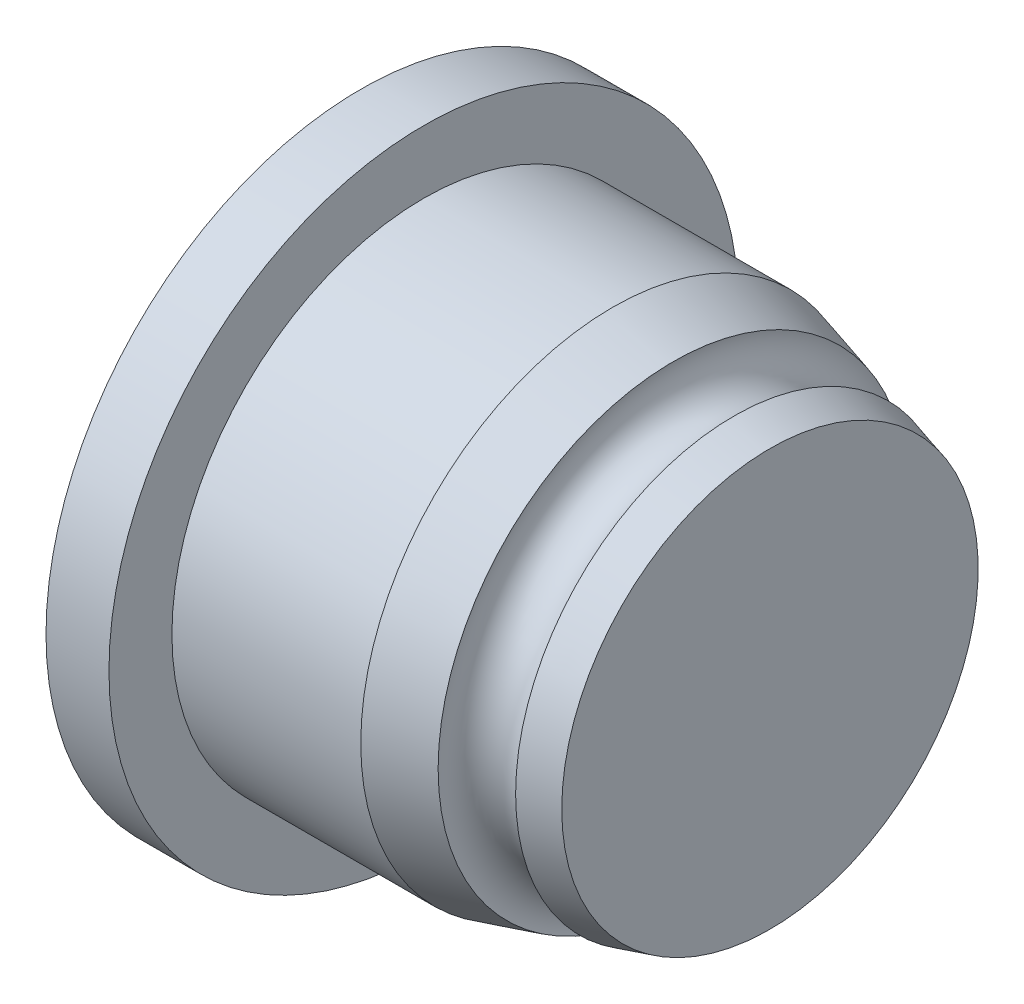
from build123d import *

# Parameters (mm, degrees)
SKETCH3_R               = 1.75
BOSS_EXTRUDE1_DEPTH     = 4
CUT_EXTRUDE1_DEPTH      = 10.604686356
CUT_EXTRUDE1_DEPTH_BACK = 5
SKETCH4_R               = 2.55


with BuildPart() as part:
    # Sketch2 → Revolve1 (revolve)
    with BuildSketch(Plane(origin=(0, 0, 0), x_dir=(1, 0, 0), z_dir=(0, 1, 0)), mode=Mode.PRIVATE) as revolve1_sk:
        with BuildLine():
            Line((0, 0), (0, 5))
            Line((0, 5), (1, 5))
            Line((1, 5), (1, 4))
            Line((1, 4), (4, 4))
            Line((4, 4), (4.962239732, 3.733469404))
            ThreePointArc((4.962239732, 3.733469404), (5.310627067, 3.11814326), (5.925953212, 3.466530596))
            Line((5.925953212, 3.466530596), (6.5, 3.307525488))
            Line((6.5, 3.307525488), (6.5, 0))
            Line((6.5, 0), (0, 0))
        make_face()
    revolve(revolve1_sk.sketch.rotate(Axis((0, 0, 0), (1, 0, 0)), 180), axis=Axis((0, 0, 0), (1, 0, 0)))

    # Sketch3 → Boss-Extrude1 (add)
    with BuildSketch(Plane.ZY):
        Circle(SKETCH3_R)
    extrude(amount=-BOSS_EXTRUDE1_DEPTH)

    # Sketch4 → Cut-Extrude1 (cut, two sides: drawn at the far end of the back side and taken through both)
    with BuildSketch(Plane.ZY.offset(-CUT_EXTRUDE1_DEPTH_BACK)):
        with Locations(Location((0, 0, 0), (0, 0, 180))):
            Circle(SKETCH4_R)
    extrude(amount=CUT_EXTRUDE1_DEPTH + CUT_EXTRUDE1_DEPTH_BACK, mode=Mode.SUBTRACT)


solid = part.part
